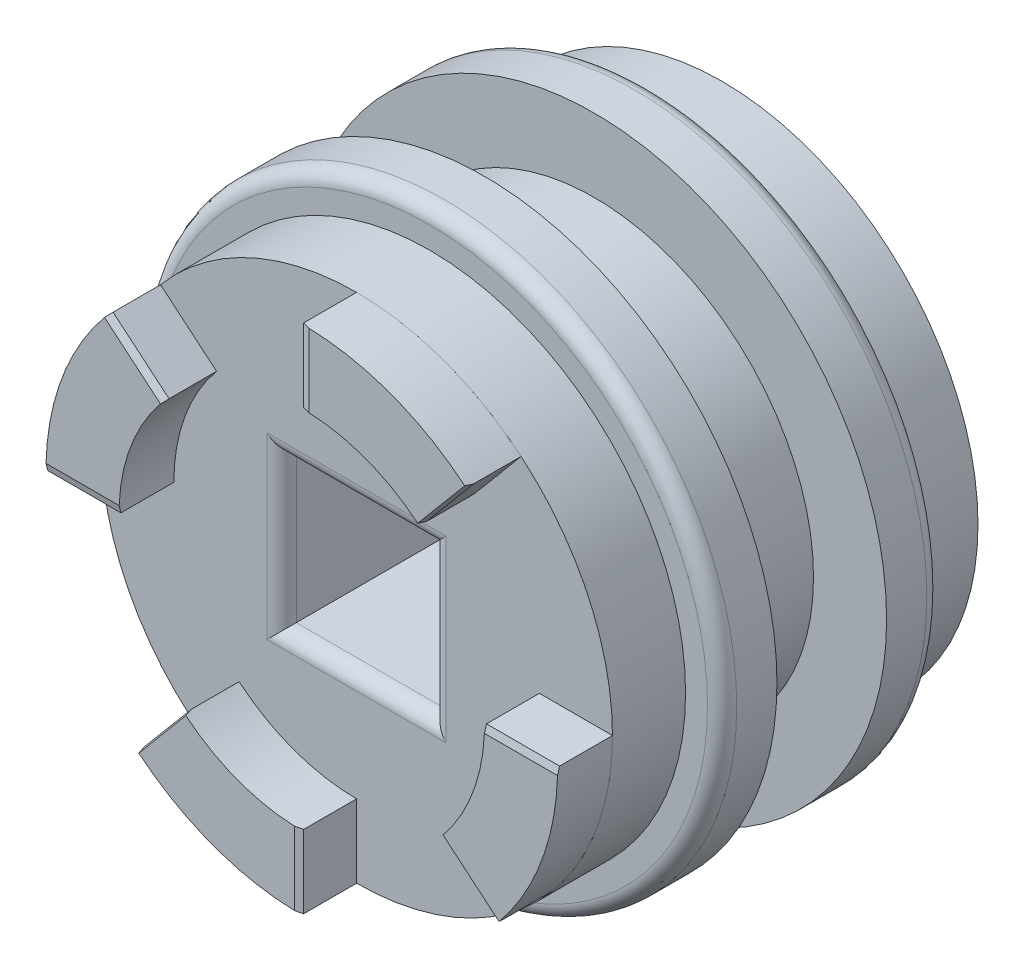
from build123d import *
from OCP.BRepFilletAPI import BRepFilletAPI_MakeChamfer

# Parameters (mm, degrees)
SKETCH1_R               = 7
BOSS_EXTRUDE1_DEPTH     = 10
BOSS_EXTRUDE2_DEPTH     = 1.5
CHAMFER2_SIZE           = 0.2
CHAMFER2_SIZE2          = 0.053589838
CIRPATTERN1_COUNT       = 4
SKETCH11_W              = 4.1
SKETCH11_H              = 4.1
CUT_EXTRUDE1_DEPTH      = 10
SKETCH12_R              = 8
SKETCH12_R_2            = 7
BOSS_EXTRUDE3_DEPTH     = 3
SKETCH12_2_R            = 8
SKETCH12_2_R_2          = 6
CUT_EXTRUDE_THIN1_DEPTH = 1.5
FILLET3_R               = 0.4
SKETCH11_3_R            = 4
SKETCH11_3_W            = 4.1
SKETCH11_3_H            = 4.1
CUT_EXTRUDE2_DEPTH      = 2
FILLET2_R               = 0.4


with BuildPart() as part:
    # Sketch1 → Boss-Extrude1 (new body)
    with BuildSketch(Plane.XY):
        Circle(SKETCH1_R)
    extrude(amount=BOSS_EXTRUDE1_DEPTH)

    # Sketch11 → Cut-Extrude1 (cut)
    with BuildSketch(Plane(origin=(0, 0, 0), x_dir=(-1, 0, 0), z_dir=(0, 0, -1))):
        Rectangle(SKETCH11_W, SKETCH11_H)
    extrude(amount=-CUT_EXTRUDE1_DEPTH, mode=Mode.SUBTRACT)

    # Sketch12 → Boss-Extrude3 (add, symmetric)
    with BuildSketch(Plane.XY.offset(5)):
        Circle(SKETCH12_R)
        Circle(SKETCH12_R_2, mode=Mode.SUBTRACT)
    extrude(amount=BOSS_EXTRUDE3_DEPTH, both=True)

    # Sketch12<2> → Cut-Extrude-Thin1 (cut, symmetric)
    with BuildSketch(Plane.XY.offset(5)):
        Circle(SKETCH12_2_R)
        Circle(SKETCH12_2_R_2, mode=Mode.SUBTRACT)
    extrude(amount=CUT_EXTRUDE_THIN1_DEPTH, both=True, mode=Mode.SUBTRACT)

    # Fillet3
    fillet3_edges = [part.edges().sort_by_distance(p)[0] for p in [
        (-8, 0, 8),
        (-8, 0, 2),
    ]]
    fillet(fillet3_edges, radius=FILLET3_R)

    # Sketch11<3> → Cut-Extrude2 (cut)
    with BuildSketch(Plane(origin=(0, 0, 0), x_dir=(-1, 0, 0), z_dir=(0, 0, -1))):
        Circle(SKETCH11_3_R)
        Rectangle(SKETCH11_3_W, SKETCH11_3_H, mode=Mode.SUBTRACT)
    extrude(amount=-CUT_EXTRUDE2_DEPTH, mode=Mode.SUBTRACT)

    # Fillet2
    fillet2_edges = [part.edges().sort_by_distance(p)[0] for p in [
        (0, 2.05, 10),
        (-2.05, 0, 10),
        (0, -2.05, 10),
        (2.05, 0, 10),
        (0, -2.05, 2),
        (2.05, 0, 2),
        (-2.05, 0, 2),
        (0, 2.05, 2),
    ]]
    fillet(fillet2_edges, radius=FILLET2_R)


with BuildPart() as body_2:
    # Sketch2 → Boss-Extrude2 (new body)
    with BuildSketch(Plane.XY.offset(10)):
        with BuildLine():
            Line((0, 7), (0, 5))
            ThreePointArc((0, 5), (0.348782369, 4.987820251), (0.695865505, 4.951340344))
            Line((0.695865505, 4.951340344), (0.974211707, 6.931876481))
            ThreePointArc((0.974211707, 6.931876481), (0.488295316, 6.982948352), (0, 7))
        make_face()
        with BuildLine():
            Line((0.974211707, 6.931876481), (0.695865505, 4.951340344))
            ThreePointArc((0.695865505, 4.951340344), (2.033683215, 4.567727288), (3.213938048, 3.830222216))
            Line((3.213938048, 3.830222216), (4.499513268, 5.362311102))
            ThreePointArc((4.499513268, 5.362311102), (2.847156502, 6.394818203), (0.974211707, 6.931876481))
        make_face()
    extrude(amount=BOSS_EXTRUDE2_DEPTH)

    # Chamfer2: one chamfer whose edges measure the first distance from different faces: ONE call of the kernel's chamfer builder (chamfer() names one face for all edges)
    chamfer2_edges_1 = [body_2.edges().sort_by_distance(p)[0] for p in [
        (3.856725658, 4.596266659, 11.5),
    ]]
    chamfer2_side_1 = [body_2.faces().sort_by_distance(p)[0] for p in [
        (3.856725658, 4.596266659, 10.75),
    ]]
    chamfer2_edges_2 = [body_2.edges().sort_by_distance(p)[0] for p in [
        (0, 6, 11.5),
    ]]
    chamfer2_side_2 = [body_2.faces().sort_by_distance(p)[0] for p in [
        (2.029317492, 5.575503986, 11.5),
    ]]
    chamfer2 = BRepFilletAPI_MakeChamfer(body_2.part.solid().wrapped)
    for e in chamfer2_edges_1:
        chamfer2.Add(CHAMFER2_SIZE, CHAMFER2_SIZE2, e.wrapped, chamfer2_side_1[0].wrapped)  # the first distance lies on this face
    for e in chamfer2_edges_2:
        chamfer2.Add(CHAMFER2_SIZE, CHAMFER2_SIZE2, e.wrapped, chamfer2_side_2[0].wrapped)  # the first distance lies on this face
    add(Compound.cast(chamfer2.Shape()), mode=Mode.REPLACE)


with BuildPart() as cirpattern1_1:
    # CirPattern1: pattern copy
    add(body_2.part.rotate(Axis((0, 0, 0), (0, 0, 1)), 1 * 360 / CIRPATTERN1_COUNT))


with BuildPart() as cirpattern1_2:
    # CirPattern1: pattern copy
    add(body_2.part.rotate(Axis((0, 0, 0), (0, 0, 1)), 2 * 360 / CIRPATTERN1_COUNT))


with BuildPart() as cirpattern1_3:
    # CirPattern1: pattern copy
    add(body_2.part.rotate(Axis((0, 0, 0), (0, 0, 1)), 3 * 360 / CIRPATTERN1_COUNT))


solid = Compound([part.part, body_2.part, cirpattern1_1.part, cirpattern1_2.part, cirpattern1_3.part])
